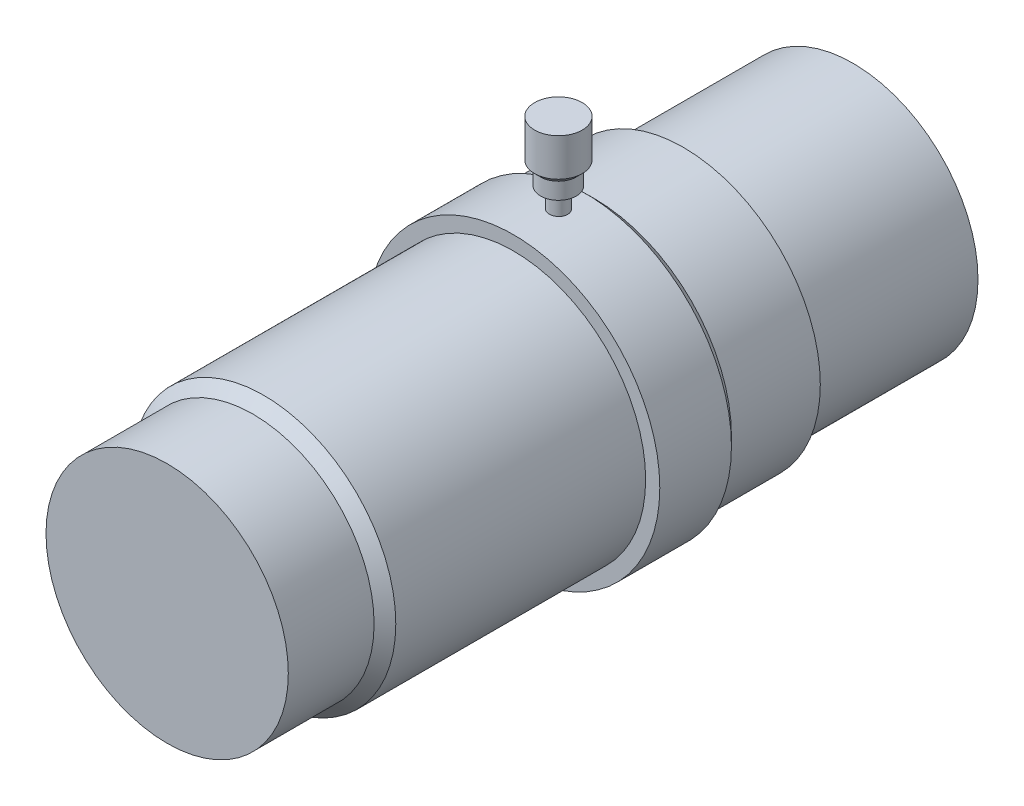
from build123d import *


with BuildPart() as part:
    # Sketch1 → Revolve1 (revolve)
    with BuildSketch(Plane(origin=(0, 0, 0), x_dir=(0, 0, -1), z_dir=(1, 0, 0)), mode=Mode.PRIVATE) as revolve1_sk:
        Polygon((0, 0), (-145.5, 0), (-145.5, 25.7), (-127.3, 25.7), (-125, 28), (-72, 28), (-72, 31), (-56.8, 31), (-54.85, 29.05), (-36, 29.05), (-36, 26.5), (0, 26.5), align=None)
    revolve(revolve1_sk.sketch.rotate(Axis((0, 0, 0), (0, 0, -1)), 90), axis=Axis((0, 0, 0), (0, 0, -1)))

    # Sketch2 → Revolve2 (revolve)
    with BuildSketch(Plane(origin=(0, 0, 0), x_dir=(0, 0, -1), z_dir=(1, 0, 0))):
        Polygon((-62.5, 31), (-62.5, 48), (-57.45, 48), (-57.45, 40), (-58.7, 38.75), (-58.7, 35.25), (-60.55, 35.25), (-60.55, 29), (-62.5, 29), align=None)
    revolve(axis=Axis((0, 48, 62.5), (0, 1, 0)))


solid = part.part
